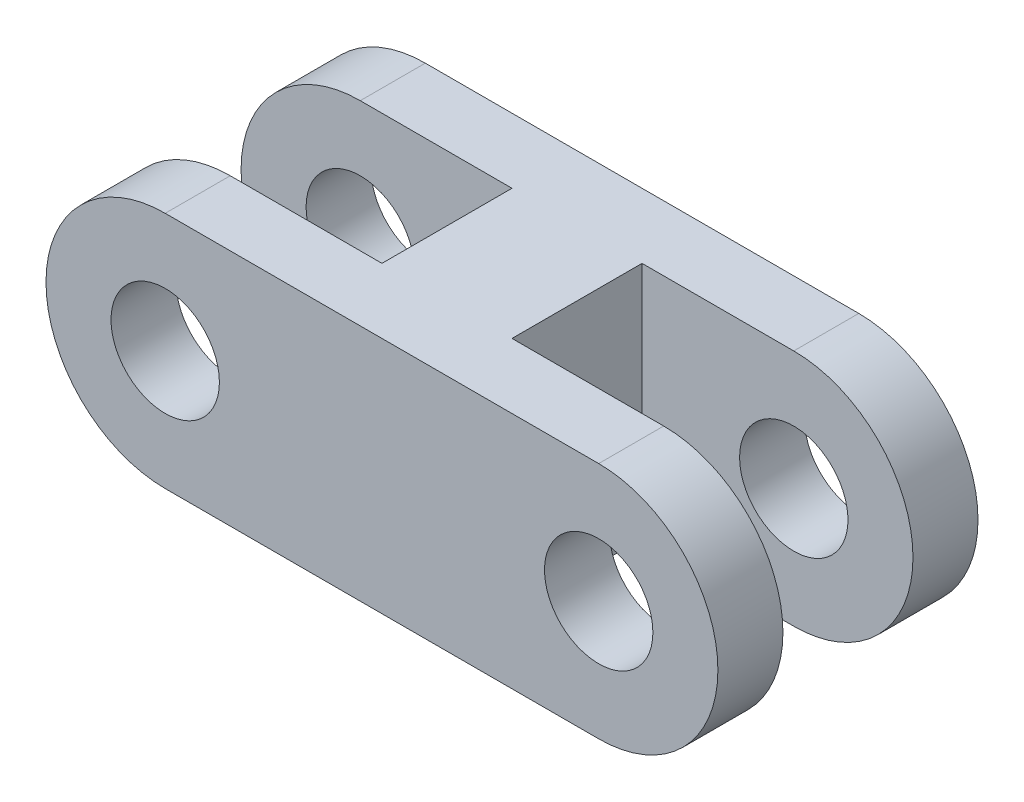
from build123d import *

# Parameters (mm, degrees)
BOSS_EXTRUDE1_DEPTH = 12
SKETCH6_W           = 12.5
SKETCH6_H           = 6
CUT_EXTRUDE1_DEPTH  = 31.253099015
SKETCH2_R           = 2.5
CUT_EXTRUDE2_DEPTH  = 29.714108031


with BuildPart() as part:
    # Sketch5 → Boss-Extrude1 (new body)
    with BuildSketch(Plane.XY):
        with BuildLine():
            Line((0, 5.5), (20, 5.5))
            ThreePointArc((20, 5.5), (25.5, 0), (20, -5.5))
            Line((20, -5.5), (0, -5.5))
            ThreePointArc((0, -5.5), (-5.5, 0), (0, 5.5))
        make_face()
    extrude(amount=BOSS_EXTRUDE1_DEPTH)

    # Sketch6 → Cut-Extrude1 (cut, through all)
    with BuildSketch(Plane(origin=(0, 5.5, 0), x_dir=(1, 0, 0), z_dir=(0, 1, 0))):
        with Locations((0.75, -6)):
            Rectangle(SKETCH6_W, SKETCH6_H)
        with Locations((19.25, -6)):
            Rectangle(SKETCH6_W, SKETCH6_H)
    extrude(amount=-CUT_EXTRUDE1_DEPTH, mode=Mode.SUBTRACT)

    # Sketch2 → Cut-Extrude2 (cut, through all)
    with BuildSketch(Plane.XY):
        Circle(SKETCH2_R)
        with Locations(Location((20, 0, 0), (0, 0, 180))):
            Circle(SKETCH2_R)
    extrude(amount=CUT_EXTRUDE2_DEPTH, mode=Mode.SUBTRACT)


solid = part.part
